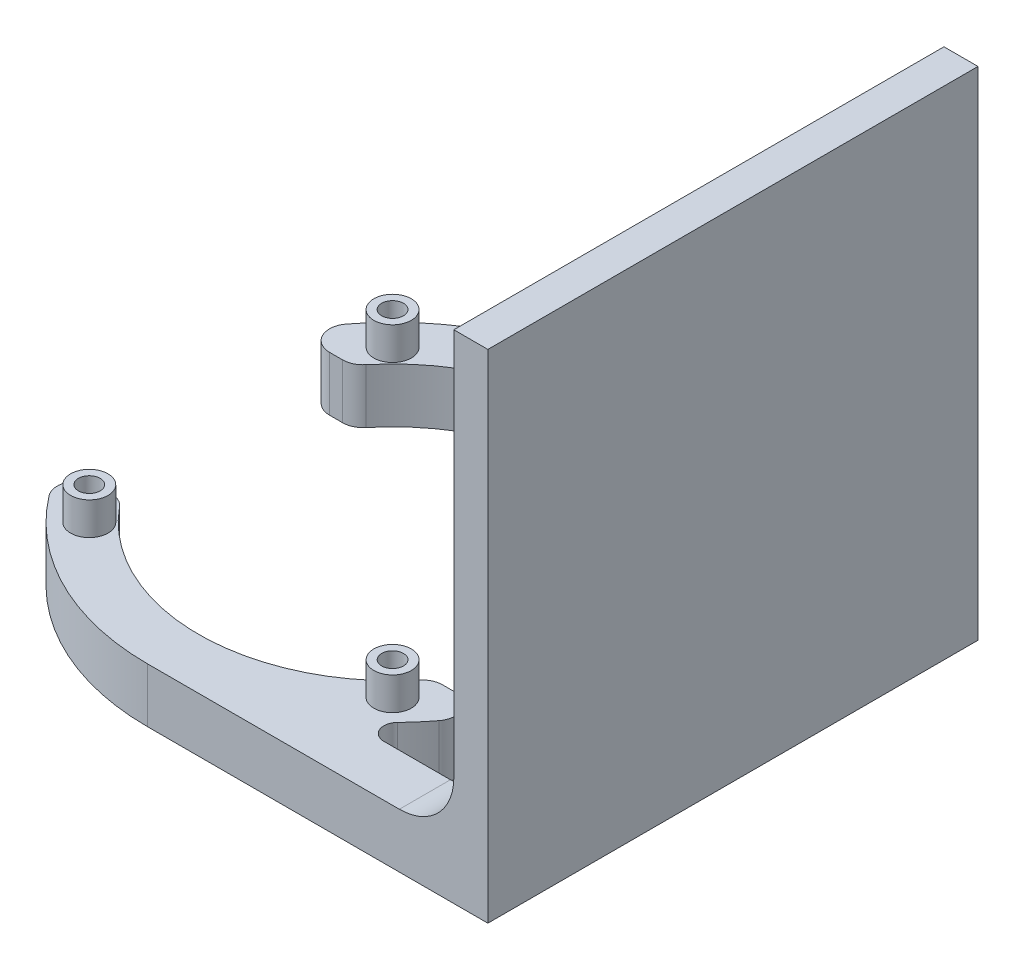
from build123d import *

# Parameters (mm, degrees)
SKETCH1_R           = 28.5
BOSS_EXTRUDE2_DEPTH = 8
SKETCH3_R           = 2.75
SKETCH3_R_2         = 1.6
BOSS_EXTRUDE3_DEPTH = 4.8
CUT_EXTRUDE1_START  = -8
SKETCH4_R           = 1.6
CUT_EXTRUDE1_DEPTH  = 8
SKETCH5_W           = 5
SKETCH5_H           = 72
BOSS_EXTRUDE4_DEPTH = 65
CIRPATTERN1_COUNT   = 4
SKETCH7_W           = 84.689019003
SKETCH7_H           = 34
CUT_EXTRUDE2_DEPTH  = 8
FILLET2_R           = 3
FILLET3_R           = 2
FILLET4_R           = 8


with BuildPart() as part:
    # Sketch1 → Boss-Extrude2 (new body)
    with BuildSketch(Plane(origin=(0, 0, 0), x_dir=(1, 0, 0), z_dir=(0, 1, 0))):
        with BuildLine():
            Line((0, 36), (50, 36))
            Line((50, 36), (50, -36))
            Line((50, -36), (0, -36))
            ThreePointArc((0, -36), (-36, 0), (0, 36))
        make_face()
        with Locations(Location((0, 0, 0), (0, 0, 270))):
            Circle(SKETCH1_R, mode=Mode.SUBTRACT)
        with BuildLine():
            Line((21.994317448, 28.5), (45, 28.5))
            Line((45, 28.5), (45, -28.5))
            Line((45, -28.5), (21.994317448, -28.5))
            ThreePointArc((21.994317448, -28.5), (36, 0), (21.994317448, 28.5))
        make_face(mode=Mode.SUBTRACT)
    extrude(amount=BOSS_EXTRUDE2_DEPTH)

    # Sketch3 → Boss-Extrude3 (add)
    with BuildSketch(Plane(origin=(0, 8, 0), x_dir=(1, 0, 0), z_dir=(0, 1, 0))):
        with Locations(Location((-22.273863607, 22.273863607, 0), (0, 0, 270))):
            Circle(SKETCH3_R)
        with Locations(Location((-22.273863607, 22.273863607, 0), (0, 0, 270))):
            Circle(SKETCH3_R_2, mode=Mode.SUBTRACT)
    boss_extrude3 = extrude(amount=BOSS_EXTRUDE3_DEPTH)

    # Sketch4 → Cut-Extrude1 (cut)
    with BuildSketch(Plane(origin=(0, 8, 0), x_dir=(1, 0, 0), z_dir=(0, 1, 0)).offset(CUT_EXTRUDE1_START)):
        with Locations(Location((-22.273863607, 22.273863607, 0), (0, 0, 270))):
            Circle(SKETCH4_R)
    cut_extrude1 = extrude(amount=CUT_EXTRUDE1_DEPTH, mode=Mode.SUBTRACT)

    # Sketch5 → Boss-Extrude4 (add)
    with BuildSketch(Plane(origin=(0, 8, 0), x_dir=(1, 0, 0), z_dir=(0, 1, 0))):
        with Locations((47.5, 0)):
            Rectangle(SKETCH5_W, SKETCH5_H)
    extrude(amount=BOSS_EXTRUDE4_DEPTH)

    # CirPattern1: Boss-Extrude3, Cut-Extrude1 ×4 about axis
    cirpattern1_axis = Axis((0, 0, 0), (0, 1, 0))
    add([boss_extrude3.rotate(cirpattern1_axis, i * 360 / CIRPATTERN1_COUNT) for i in range(1, CIRPATTERN1_COUNT)])
    add([cut_extrude1.rotate(cirpattern1_axis, i * 360 / CIRPATTERN1_COUNT) for i in range(1, CIRPATTERN1_COUNT)], mode=Mode.SUBTRACT)

    # Sketch7 → Cut-Extrude2 (cut)
    with BuildSketch(Plane.XZ):
        with Locations((-4.710445778, 0)):
            Rectangle(SKETCH7_W, SKETCH7_H)
    extrude(amount=-CUT_EXTRUDE2_DEPTH, mode=Mode.SUBTRACT)

    # Fillet2
    fillet2_edges = [part.edges().sort_by_distance(p)[0] for p in [
        (22.874658467, 4, -17),
        (-31.733263305, 4, -17),
        (31.733263305, 4, -17),
        (-31.733263305, 4, 17),
        (31.733263305, 4, 17),
        (22.874658467, 4, 17),
        (-22.874658467, 4, 17),
        (-22.874658467, 4, -17),
    ]]
    fillet(fillet2_edges, radius=FILLET2_R)

    # Fillet3
    fillet3_edges = [part.edges().sort_by_distance(p)[0] for p in [
        (21.994317448, 4, -28.5),
        (21.994317448, 4, 28.5),
    ]]
    fillet(fillet3_edges, radius=FILLET3_R)

    # Fillet4
    fillet4_edges = [part.edges().sort_by_distance(p)[0] for p in [
        (45, 8, -32.25),
        (45, 8, 32.25),
    ]]
    fillet(fillet4_edges, radius=FILLET4_R)


solid = part.part
